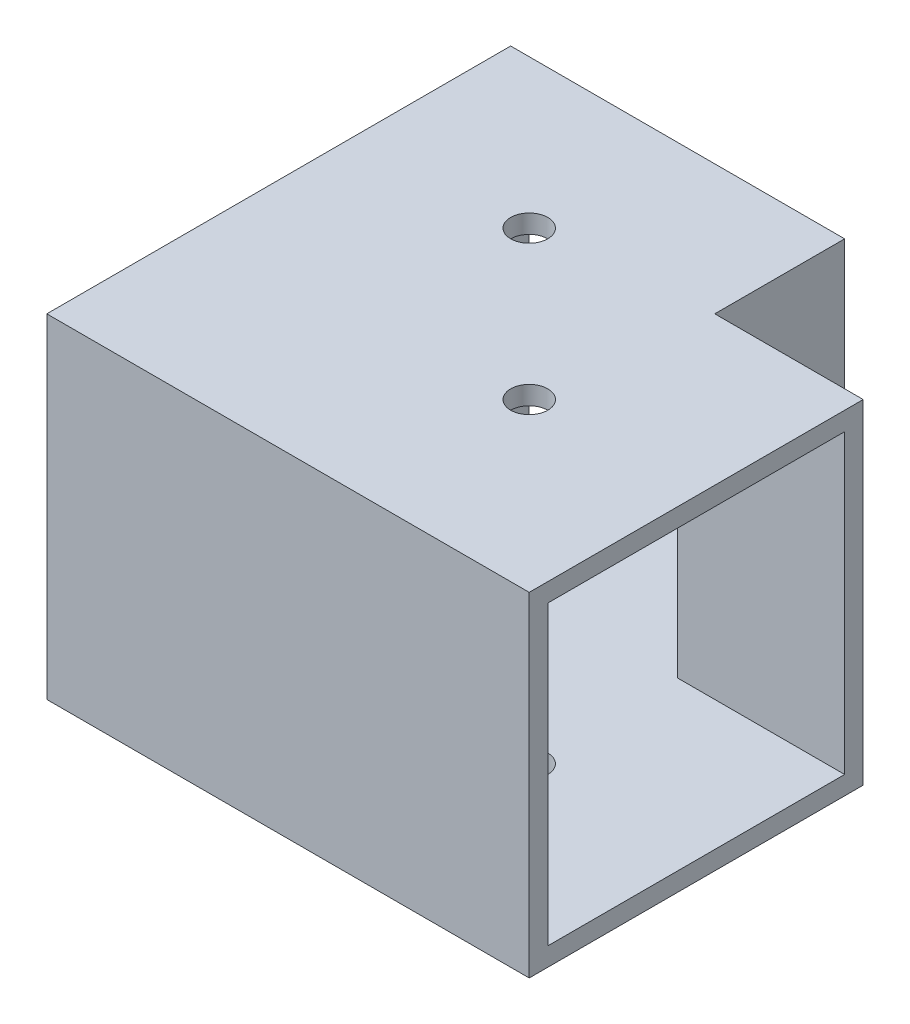
from build123d import *

# Parameters (mm, degrees)
SKETCH1_W           = 114.3
SKETCH1_H           = 114.3
SKETCH1_W_2         = 101.6
SKETCH1_H_2         = 101.6
EXTRUDE_THIN1_DEPTH = 50.8
SKETCH3_W           = 114.3
SKETCH3_H           = 114.3
SKETCH3_W_2         = 101.6
SKETCH3_H_2         = 101.6
EXTRUDE_THIN2_DEPTH = 50.8
BOSS_EXTRUDE1_DEPTH = 114.3
SKETCH6_R           = 6.35
CUT_EXTRUDE1_DEPTH  = 224.426173489


with BuildPart() as part:
    # Sketch1 → Extrude-Thin1 (new body)
    with BuildSketch(Plane.XY):
        Rectangle(SKETCH1_W, SKETCH1_H)
        Rectangle(SKETCH1_W_2, SKETCH1_H_2, mode=Mode.SUBTRACT)
    extrude(amount=EXTRUDE_THIN1_DEPTH)

    # Sketch3 → Extrude-Thin2 (add)
    with BuildSketch(Plane(origin=(57.15, 0, 0), x_dir=(0, 0, -1), z_dir=(1, 0, 0))):
        with Locations((-101.6, 0)):
            Rectangle(SKETCH3_W, SKETCH3_H)
        with Locations((-101.6, 0)):
            Rectangle(SKETCH3_W_2, SKETCH3_H_2, mode=Mode.SUBTRACT)
    extrude(amount=EXTRUDE_THIN2_DEPTH)

    # Sketch4 → Boss-Extrude1 (add)
    with BuildSketch(Plane.ZY.offset(-57.15)):
        Polygon((50.8, -50.8), (50.8, -57.15), (158.75, -57.15), (158.75, 57.15), (50.8, 57.15), (50.8, 50.8), (152.4, 50.8), (152.4, -50.8), align=None)
    extrude(amount=BOSS_EXTRUDE1_DEPTH)

    # Sketch6 → Cut-Extrude1 (cut, through all)
    with BuildSketch(Plane(origin=(0, 57.15, 0), x_dir=(1, 0, 0), z_dir=(0, 1, 0))):
        with Locations(Location((0, -50.8, 0), (0, 0, 270))):
            Circle(SKETCH6_R)
    cut_extrude1 = extrude(amount=-CUT_EXTRUDE1_DEPTH, mode=Mode.SUBTRACT)

    # Mirror1: Cut-Extrude1 across plane
    add(cut_extrude1.mirror(Plane(origin=(50.8, 0, 50.8), x_dir=(-0.7071067811865477, 0, 0.7071067811865474), z_dir=(0.7071067811865476, 0, 0.7071067811865476))), mode=Mode.SUBTRACT)


solid = part.part
